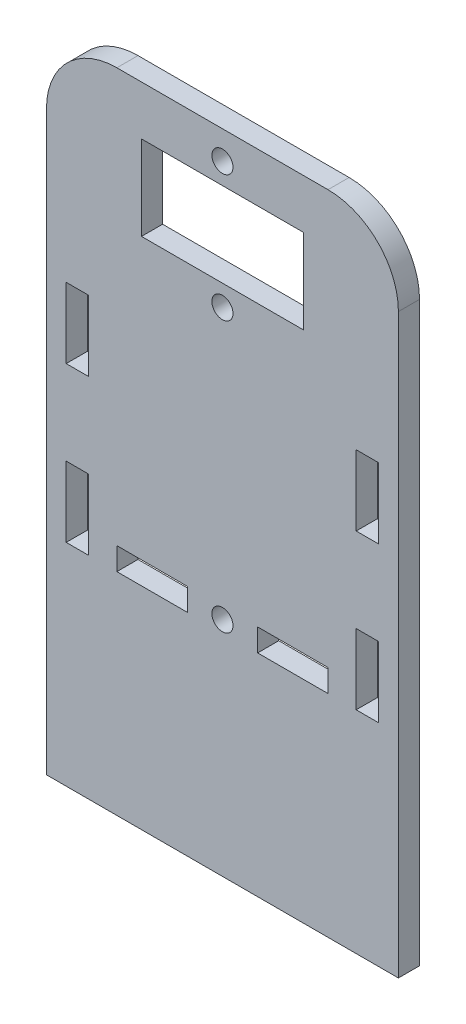
from build123d import *

# Parameters (mm, degrees)
CROQUIS1_R              = 1.5
CROQUIS1_W              = 3.2
CROQUIS1_H              = 10
CROQUIS1_W_2            = 23
CROQUIS1_H_2            = 12
CROQUIS1_W_3            = 10
CROQUIS1_H_3            = 3.2
SALIENTE_EXTRUIR1_DEPTH = 3


with BuildPart() as part:
    # Croquis1 → Saliente-Extruir1 (new body)
    with BuildSketch(Plane.XY):
        with BuildLine():
            Line((25, -46), (-25, -46))
            Line((-25, -46), (-25, 36))
            ThreePointArc((-25, 36), (-22.071067812, 43.071067812), (-15, 46))
            Line((-15, 46), (15, 46))
            ThreePointArc((15, 46), (22.071067812, 43.071067812), (25, 36))
            Line((25, 36), (25, -46))
        make_face()
        with Locations((0, 42)):
            Circle(CROQUIS1_R, mode=Mode.SUBTRACT)
        with Locations(Location((0, 24, 0), (0, 0, 180))):
            Circle(CROQUIS1_R, mode=Mode.SUBTRACT)
        with Locations((0, -14.4)):
            Circle(CROQUIS1_R, mode=Mode.SUBTRACT)
        with Locations((-20.6, 11)):
            Rectangle(CROQUIS1_W, CROQUIS1_H, mode=Mode.SUBTRACT)
        with Locations((-20.6, -11)):
            Rectangle(CROQUIS1_W, CROQUIS1_H, mode=Mode.SUBTRACT)
        with Locations((20.6, 11)):
            Rectangle(CROQUIS1_W, CROQUIS1_H, mode=Mode.SUBTRACT)
        with Locations((20.6, -11)):
            Rectangle(CROQUIS1_W, CROQUIS1_H, mode=Mode.SUBTRACT)
        with Locations((0, 33)):
            Rectangle(CROQUIS1_W_2, CROQUIS1_H_2, mode=Mode.SUBTRACT)
        with Locations((10, -14.4)):
            Rectangle(CROQUIS1_W_3, CROQUIS1_H_3, mode=Mode.SUBTRACT)
        with Locations((-10, -14.4)):
            Rectangle(CROQUIS1_W_3, CROQUIS1_H_3, mode=Mode.SUBTRACT)
    extrude(amount=SALIENTE_EXTRUIR1_DEPTH)


solid = part.part
